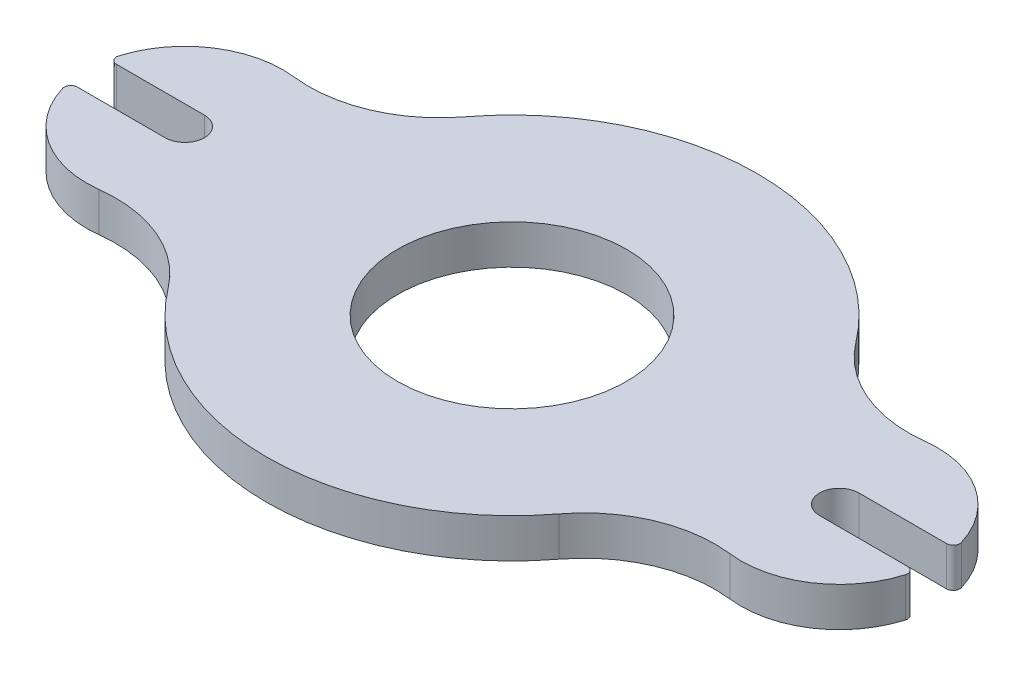
from build123d import *

# Parameters (mm, degrees)
SKETCH1_R           = 17.5
BOSS_EXTRUDE1_DEPTH = 6


with BuildPart() as part:
    # Sketch1 → Boss-Extrude1 (new body)
    with BuildSketch(Plane(origin=(0, 0, 0), x_dir=(1, 0, 0), z_dir=(0, 1, 0))):
        with BuildLine():
            Line((50, -3), (63.416407865, -3))
            ThreePointArc((63.416407865, -3), (64.218191591, -3.402385695), (64.374722712, -4.285714286))
            ThreePointArc((64.374722712, -4.285714286), (58.227349417, -12.542357098), (48.205357143, -14.892254934))
            ThreePointArc((48.205357143, -14.892254934), (38.006177908, -16.334976641), (29.877717391, -22.662127073))
            ThreePointArc((29.877717391, -22.662127073), (0, -37.5), (-29.877717391, -22.662127073))
            ThreePointArc((-29.877717391, -22.662127073), (-38.006177908, -16.334976641), (-48.205357143, -14.892254934))
            ThreePointArc((-48.205357143, -14.892254934), (-58.227349417, -12.542357098), (-64.374722712, -4.285714286))
            ThreePointArc((-64.374722712, -4.285714286), (-64.218191591, -3.402385695), (-63.416407865, -3))
            Line((-63.416407865, -3), (-50, -3))
            ThreePointArc((-50, -3), (-47, 0), (-50, 3))
            Line((-50, 3), (-63.416407865, 3))
            ThreePointArc((-63.416407865, 3), (-64.218191591, 3.402385695), (-64.374722712, 4.285714286))
            ThreePointArc((-64.374722712, 4.285714286), (-58.227349417, 12.542357098), (-48.205357143, 14.892254934))
            ThreePointArc((-48.205357143, 14.892254934), (-38.006177908, 16.334976641), (-29.877717391, 22.662127073))
            ThreePointArc((-29.877717391, 22.662127073), (0, 37.5), (29.877717391, 22.662127073))
            ThreePointArc((29.877717391, 22.662127073), (38.006177908, 16.334976641), (48.205357143, 14.892254934))
            ThreePointArc((48.205357143, 14.892254934), (58.227349417, 12.542357098), (64.374722712, 4.285714286))
            ThreePointArc((64.374722712, 4.285714286), (64.218191591, 3.402385695), (63.416407865, 3))
            Line((63.416407865, 3), (50, 3))
            ThreePointArc((50, 3), (47, 0), (50, -3))
        make_face()
        with Locations(Location((0, 0, 0), (0, 0, 270))):
            Circle(SKETCH1_R, mode=Mode.SUBTRACT)
    extrude(amount=BOSS_EXTRUDE1_DEPTH)


solid = part.part
